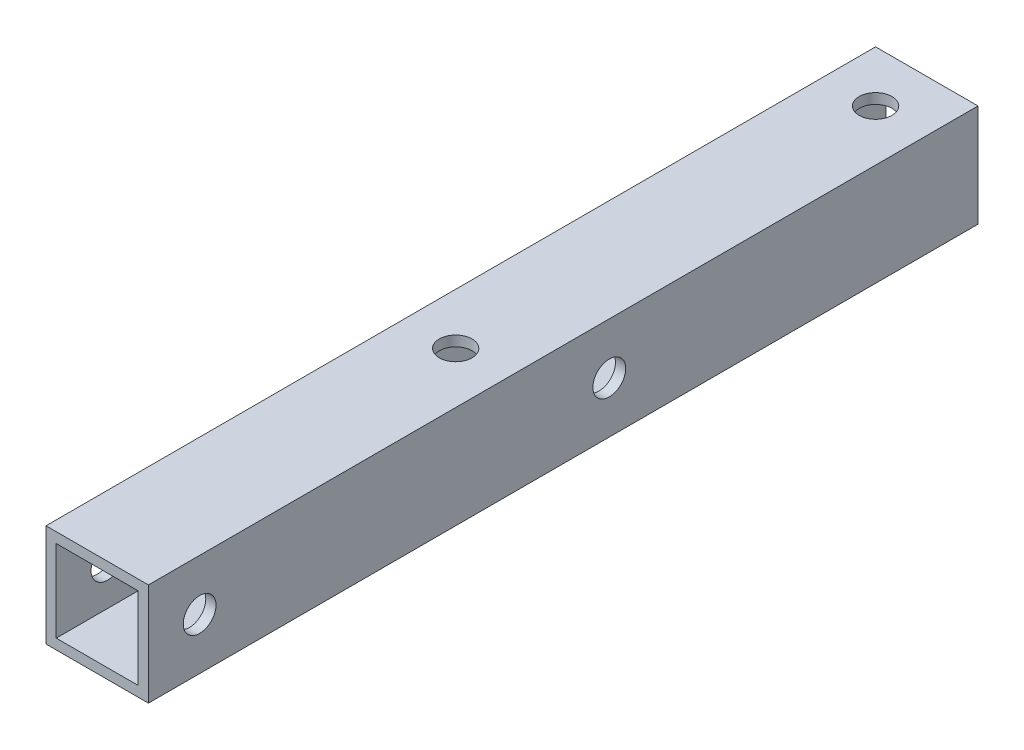
from build123d import *

# Parameters (mm, degrees)
SKETCH_1_W          = 10
SKETCH_1_H          = 10
SKETCH_1_W_2        = 8
SKETCH_1_H_2        = 8
EXTRUDE_1_DEPTH     = 51
SKETCH_2_R          = 1.6
CUT_EXTRUDE_1_DEPTH = 53.211109929
SKETCH_3_R          = 1.6
CUT_EXTRUDE_2_DEPTH = 10
SKETCH_4_W          = 10
SKETCH_4_H          = 10
SKETCH_4_W_2        = 8
SKETCH_4_H_2        = 8
EXTRUDE_1_2_DEPTH   = 30
SKETCH_5_R          = 1.6
CUT_EXTRUDE_3_DEPTH = 82.767964387


with BuildPart() as part:
    # ｽｹｯﾁ1 → Extrude 1 (new body)
    with BuildSketch(Plane.XY):
        Rectangle(SKETCH_1_W, SKETCH_1_H)
        Rectangle(SKETCH_1_W_2, SKETCH_1_H_2, mode=Mode.SUBTRACT)
    extrude(amount=EXTRUDE_1_DEPTH)

    # ｽｹｯﾁ2 → ｶｯﾄ - 押し出し1 (cut, through all)
    with BuildSketch(Plane(origin=(5, 0, 0), x_dir=(0, 0, -1), z_dir=(1, 0, 0))):
        with Locations(Location((-36, 0, 0), (0, 0, 90))):
            Circle(SKETCH_2_R)
    extrude(amount=-CUT_EXTRUDE_1_DEPTH, mode=Mode.SUBTRACT)

    # ｽｹｯﾁ3 → ｶｯﾄ - 押し出し2 (cut)
    with BuildSketch(Plane(origin=(0, 5, 0), x_dir=(1, 0, 0), z_dir=(0, 1, 0))):
        with Locations(Location((0, -46, 0), (0, 0, 180))):
            Circle(SKETCH_3_R)
        with Locations(Location((0, -5, 0), (0, 0, 180))):
            Circle(SKETCH_3_R)
    extrude(amount=-CUT_EXTRUDE_2_DEPTH, mode=Mode.SUBTRACT)

    # ｽｹｯﾁ4 → Extrude 1 2 (add)
    with BuildSketch(Plane.XY.offset(51)):
        Rectangle(SKETCH_4_W, SKETCH_4_H)
        Rectangle(SKETCH_4_W_2, SKETCH_4_H_2, mode=Mode.SUBTRACT)
    extrude(amount=EXTRUDE_1_2_DEPTH)

    # ｽｹｯﾁ5 → ｶｯﾄ - 押し出し3 (cut, through all)
    with BuildSketch(Plane(origin=(5, 0, 0), x_dir=(0, 0, -1), z_dir=(1, 0, 0))):
        with Locations(Location((-76, 0, 0), (0, 0, 90))):
            Circle(SKETCH_5_R)
    extrude(amount=-CUT_EXTRUDE_3_DEPTH, mode=Mode.SUBTRACT)


solid = part.part
